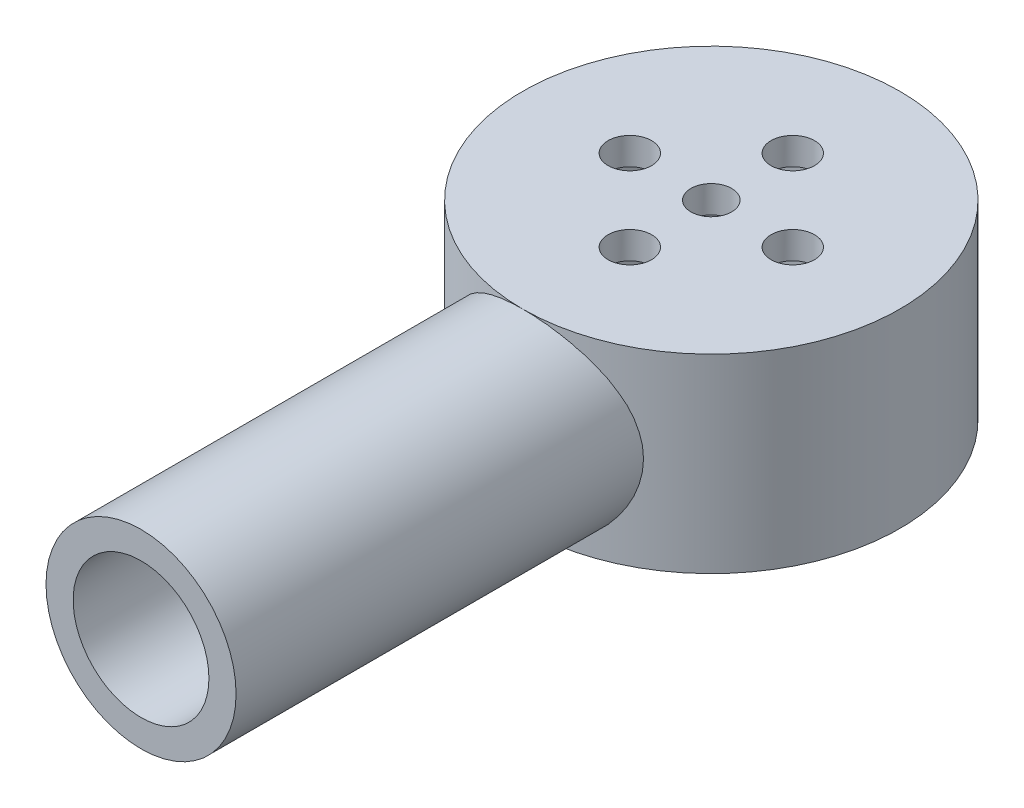
from build123d import *

# Parameters (mm, degrees)
SKETCH1_R           = 7
SKETCH1_R_2         = 5
BOSS_EXTRUDE1_DEPTH = 30
BOSS_EXTRUDE2_START = 7
SKETCH3_R           = 13.892443989
SKETCH3_R_2         = 1.5
SKETCH3_R_3         = 1.6
BOSS_EXTRUDE2_DEPTH = 14
SKETCH4_R           = 11.892443989
CUT_EXTRUDE1_DEPTH  = 12


with BuildPart() as part:
    # Sketch1 → Boss-Extrude1 (new body)
    with BuildSketch(Plane.XY):
        Circle(SKETCH1_R)
        Circle(SKETCH1_R_2, mode=Mode.SUBTRACT)
    extrude(amount=-BOSS_EXTRUDE1_DEPTH)


with BuildPart() as body_2:
    # Sketch3 → Boss-Extrude2 (new body)
    with BuildSketch(Plane(origin=(0, 0, 0), x_dir=(1, 0, 0), z_dir=(0, 1, 0)).offset(BOSS_EXTRUDE2_START)):
        with Locations(Location((0, 42, 0), (0, 0, 270))):
            Circle(SKETCH3_R)
        with Locations(Location((0, 42, 0), (0, 0, 270))):
            Circle(SKETCH3_R_2, mode=Mode.SUBTRACT)
        with Locations(Location((0, 36, 0), (0, 0, 270))):
            Circle(SKETCH3_R_3, mode=Mode.SUBTRACT)
        with Locations(Location((-6, 42, 0), (0, 0, 270))):
            Circle(SKETCH3_R_3, mode=Mode.SUBTRACT)
        with Locations(Location((6, 42, 0), (0, 0, 270))):
            Circle(SKETCH3_R_3, mode=Mode.SUBTRACT)
        with Locations(Location((0, 48, 0), (0, 0, 270))):
            Circle(SKETCH3_R_3, mode=Mode.SUBTRACT)
    extrude(amount=-BOSS_EXTRUDE2_DEPTH)

    # Sketch4 → Cut-Extrude1 (cut)
    with BuildSketch(Plane.XZ.offset(7)):
        with Locations(Location((0, -42, 0), (0, 0, 270))):
            Circle(SKETCH4_R)
    extrude(amount=-CUT_EXTRUDE1_DEPTH, mode=Mode.SUBTRACT)


solid = Compound([part.part, body_2.part])
